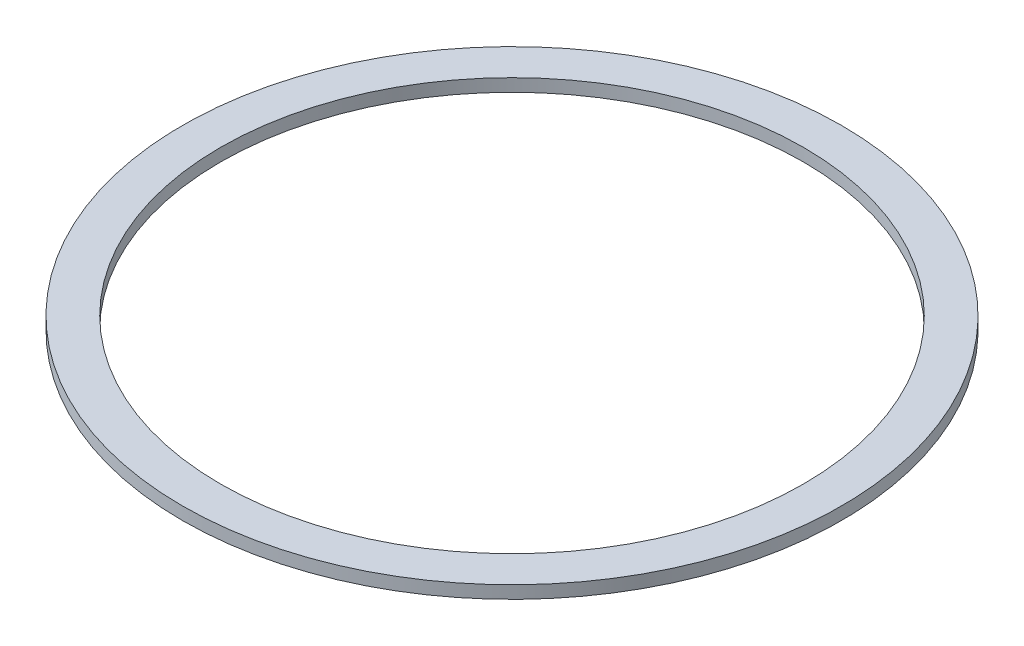
from build123d import *

# Parameters (mm, degrees)
SKETCH1_R           = 33.02
SKETCH1_R_2         = 29.21
BOSS_EXTRUDE1_DEPTH = 1.27


with BuildPart() as part:
    # Sketch1 → Boss-Extrude1 (new body)
    with BuildSketch(Plane(origin=(0, 0, 0), x_dir=(1, 0, 0), z_dir=(0, 1, 0))):
        with Locations(Location((0, 0, 0), (0, 0, 270))):
            Circle(SKETCH1_R)
        with Locations(Location((0, 0, 0), (0, 0, 270))):
            Circle(SKETCH1_R_2, mode=Mode.SUBTRACT)
    extrude(amount=BOSS_EXTRUDE1_DEPTH)


solid = part.part
